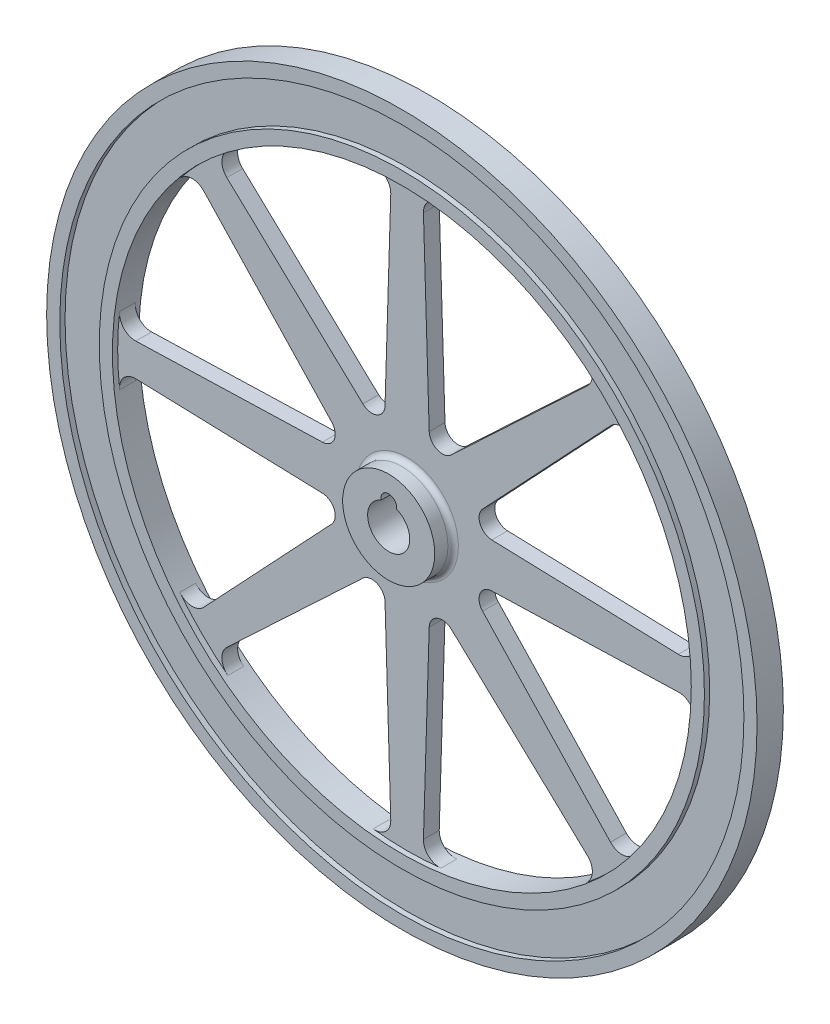
from build123d import *

# Parameters (mm, degrees)
SKETCH1_R           = 17.5
BOSS_EXTRUDE1_DEPTH = 10
SKETCH1_4_R         = 130
SKETCH1_4_R_2       = 115
SKETCH1_4_R_3       = 17.5
BOSS_EXTRUDE3_DEPTH = 3
SKETCH1_5_R         = 135
SKETCH1_5_R_2       = 130
SKETCH1_5_R_3       = 115
SKETCH1_5_R_4       = 110
BOSS_EXTRUDE4_DEPTH = 5
FILLET1_R           = 6
FILLET2_R           = 2


with BuildPart() as part:
    # Sketch1 → Boss-Extrude1 (new, symmetric)
    with BuildSketch(Plane.XY):
        Circle(SKETCH1_R)
        with BuildLine():
            ThreePointArc((2.946793809, 7.4375), (6.617187865, 4.495867521), (8, 0))
            ThreePointArc((8, 0), (-4.495867521, -6.617187865), (-2.946793809, 7.4375))
            ThreePointArc((-2.946793809, 7.4375), (0, 11), (2.946793809, 7.4375))
        make_face(mode=Mode.SUBTRACT)
    extrude(amount=BOSS_EXTRUDE1_DEPTH, both=True)

    # Sketch1<4> → Boss-Extrude3 (add, symmetric)
    # profile 1 of 2: a face of its own
    with BuildSketch(Plane.XY):
        Circle(SKETCH1_4_R)
        Circle(SKETCH1_4_R_2, mode=Mode.SUBTRACT)
    # profile 2 of 2: a face of its own
    with BuildSketch(Plane.XY):
        with BuildLine():
            Line((8.396299036, 32.18156505), (6, 109.836241742))
            ThreePointArc((6, 109.836241742), (0, 110), (-6, 109.836241742))
            Line((-6, 109.836241742), (-8.396299036, 32.18156505))
            ThreePointArc((-8.396299036, 32.18156505), (-11.480502971, 27.716385975), (-16.818722891, 28.692882861))
            Line((-16.818722891, 28.692882861), (-73.423310669, 81.908592043))
            ThreePointArc((-73.423310669, 81.908592043), (-77.781745931, 77.781745931), (-81.908592043, 73.423310669))
            Line((-81.908592043, 73.423310669), (-28.692882861, 16.818722891))
            ThreePointArc((-28.692882861, 16.818722891), (-27.716385975, 11.480502971), (-32.18156505, 8.396299036))
            Line((-32.18156505, 8.396299036), (-109.836241742, 6))
            ThreePointArc((-109.836241742, 6), (-110, 0), (-109.836241742, -6))
            Line((-109.836241742, -6), (-32.18156505, -8.396299036))
            ThreePointArc((-32.18156505, -8.396299036), (-27.716385975, -11.480502971), (-28.692882861, -16.818722891))
            Line((-28.692882861, -16.818722891), (-81.908592043, -73.423310669))
            ThreePointArc((-81.908592043, -73.423310669), (-77.781745931, -77.781745931), (-73.423310669, -81.908592043))
            Line((-73.423310669, -81.908592043), (-16.818722891, -28.692882861))
            ThreePointArc((-16.818722891, -28.692882861), (-11.480502971, -27.716385975), (-8.396299036, -32.18156505))
            Line((-8.396299036, -32.18156505), (-6, -109.836241742))
            ThreePointArc((-6, -109.836241742), (0, -110), (6, -109.836241742))
            Line((6, -109.836241742), (8.396299036, -32.18156505))
            ThreePointArc((8.396299036, -32.18156505), (11.480502971, -27.716385975), (16.818722891, -28.692882861))
            Line((16.818722891, -28.692882861), (73.423310669, -81.908592043))
            ThreePointArc((73.423310669, -81.908592043), (77.781745931, -77.781745931), (81.908592043, -73.423310669))
            Line((81.908592043, -73.423310669), (28.692882861, -16.818722891))
            ThreePointArc((28.692882861, -16.818722891), (27.716385975, -11.480502971), (32.18156505, -8.396299036))
            Line((32.18156505, -8.396299036), (109.836241742, -6))
            ThreePointArc((109.836241742, -6), (110, 0), (109.836241742, 6))
            Line((109.836241742, 6), (32.18156505, 8.396299036))
            ThreePointArc((32.18156505, 8.396299036), (27.716385975, 11.480502971), (28.692882861, 16.818722891))
            Line((28.692882861, 16.818722891), (81.908592043, 73.423310669))
            ThreePointArc((81.908592043, 73.423310669), (77.781745931, 77.781745931), (73.423310669, 81.908592043))
            Line((73.423310669, 81.908592043), (16.818722891, 28.692882861))
            ThreePointArc((16.818722891, 28.692882861), (11.480502971, 27.716385975), (8.396299036, 32.18156505))
        make_face()
        Circle(SKETCH1_4_R_3, mode=Mode.SUBTRACT)
    extrude(amount=BOSS_EXTRUDE3_DEPTH, both=True)


with BuildPart() as boss_extrude3_piece_1:
    # of the separate pieces the step leaves, piece 1, a body of its own (boss_extrude3_pieces)
    add(part.part.solids().sort_by_distance((17.5, 0, -10))[0])



with BuildPart() as boss_extrude3_piece_2:
    # of the separate pieces the step leaves, piece 2, a body of its own (boss_extrude3_pieces)
    add(part.part.solids().sort_by_distance((130, 0, -3))[0])


with BuildPart() as boss_extrude3_piece_1_1:
    add(boss_extrude3_piece_1.part)

    add(boss_extrude3_piece_2.part)  # Boss-Extrude4 merges Boss-Extrude3 piece 2
    # Sketch1<5> → Boss-Extrude4 (add, symmetric)
    # profile 1 of 2: a face of its own
    with BuildSketch(Plane.XY):
        Circle(SKETCH1_5_R)
        Circle(SKETCH1_5_R_2, mode=Mode.SUBTRACT)
    # profile 2 of 2: a face of its own
    with BuildSketch(Plane.XY):
        Circle(SKETCH1_5_R_3)
        Circle(SKETCH1_5_R_4, mode=Mode.SUBTRACT)
    extrude(amount=BOSS_EXTRUDE4_DEPTH, both=True)

    # Fillet1
    fillet1_edges = [boss_extrude3_piece_1_1.edges().sort_by_distance(p)[0] for p in [
        (-73.423310669, 81.908592043, 0),
        (-81.908592043, 73.423310669, 0),
        (-109.836241742, -6, 0),
        (-109.836241742, 6, 0),
        (-81.908592043, -73.423310669, 0),
        (-73.423310669, -81.908592043, 0),
        (-6, -109.836241742, 0),
        (6, -109.836241742, 0),
        (81.908592043, -73.423310669, 0),
        (73.423310669, -81.908592043, 0),
        (109.836241742, 6, 0),
        (109.836241742, -6, 0),
        (73.423310669, 81.908592043, 0),
        (81.908592043, 73.423310669, 0),
        (6, 109.836241742, 0),
        (-6, 109.836241742, 0),
    ]]
    fillet(fillet1_edges, radius=FILLET1_R)

    # Fillet2
    fillet2_edges = [boss_extrude3_piece_1_1.edges().sort_by_distance(p)[0] for p in [
        (-17.5, 0, 3),
        (-17.5, 0, -3),
    ]]
    fillet(fillet2_edges, radius=FILLET2_R)


solid = boss_extrude3_piece_1_1.part
